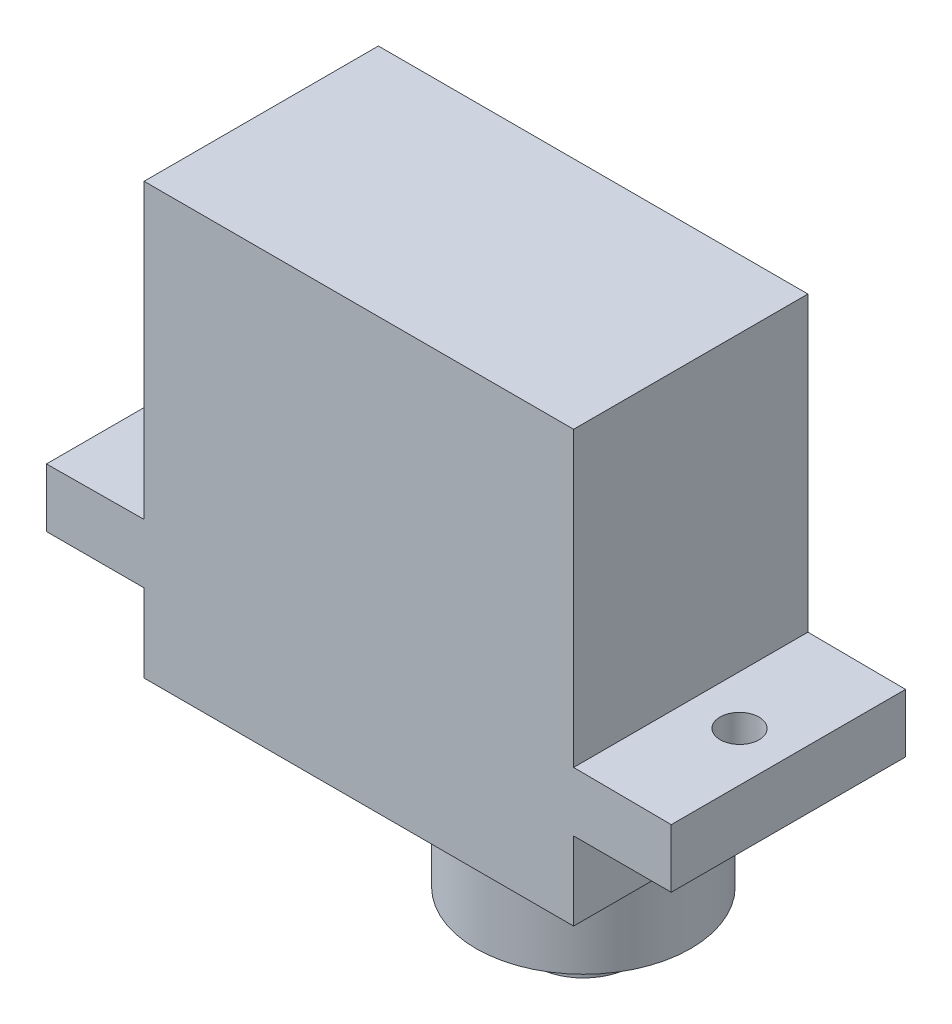
from build123d import *

# Parameters (mm, degrees)
SALIENTE_EXTRUIR1_DEPTH = 12
CROQUIS2_OUTSIDE_W      = 42.878
CROQUIS2_OUTSIDE_H      = 22.878
CROQUIS2_OUTSIDE_R      = 5.5
CORTAR_EXTRUIR1_DEPTH   = 6.285514833
CROQUIS3_OUTSIDE_W      = 42.878
CROQUIS3_OUTSIDE_H      = 22.878
CROQUIS3_OUTSIDE_R      = 2.5
CORTAR_EXTRUIR2_DEPTH   = 2.285514833
CROQUIS4_R              = 1
CORTAR_EXTRUIR3_DEPTH   = 12


with BuildPart() as part:
    # Croquis1 → Saliente-Extruir1 (new body)
    with BuildSketch(Plane.XY):
        Polygon((-16, -7.537010796), (-11, -7.5), (-11, 7.5), (11, 7.5), (11, -7.5), (16, -7.537010796), (16, -10.537010796), (11, -10.537010796), (11, -14.537010796), (11, -18.537010796), (8, -18.537010796), (8, -20.822525629), (3, -20.822525629), (3, -18.537010796), (0, -18.537010796), (0, -14.537010796), (-11, -14.537010796), (-11, -10.537010796), (-16, -10.537010796), align=None)
    extrude(amount=SALIENTE_EXTRUIR1_DEPTH)

    # Croquis2 outside → Cortar-Extruir1 (cut)
    with BuildSketch(Plane.XZ.offset(20.822525629)):
        with Locations((0, 6)):
            Rectangle(CROQUIS2_OUTSIDE_W, CROQUIS2_OUTSIDE_H)
        with Locations(Location((5.5, 6, 0), (0, 0, 297.035691789))):
            Circle(CROQUIS2_OUTSIDE_R, mode=Mode.SUBTRACT)
    extrude(amount=-CORTAR_EXTRUIR1_DEPTH, mode=Mode.SUBTRACT)

    # Croquis3 outside → Cortar-Extruir2 (cut)
    with BuildSketch(Plane.XZ.offset(20.822525629)):
        with Locations((0, 6)):
            Rectangle(CROQUIS3_OUTSIDE_W, CROQUIS3_OUTSIDE_H)
        with Locations(Location((5.5, 6, 0), (0, 0, 270))):
            Circle(CROQUIS3_OUTSIDE_R, mode=Mode.SUBTRACT)
    extrude(amount=-CORTAR_EXTRUIR2_DEPTH, mode=Mode.SUBTRACT)

    # Croquis4 → Cortar-Extruir3 (cut)
    with BuildSketch(Plane.XZ.offset(10.537010796)):
        with Locations((-13.5, 6)):
            Circle(CROQUIS4_R)
        with Locations((13.5, 6)):
            Circle(CROQUIS4_R)
    extrude(amount=-CORTAR_EXTRUIR3_DEPTH, mode=Mode.SUBTRACT)


solid = part.part
